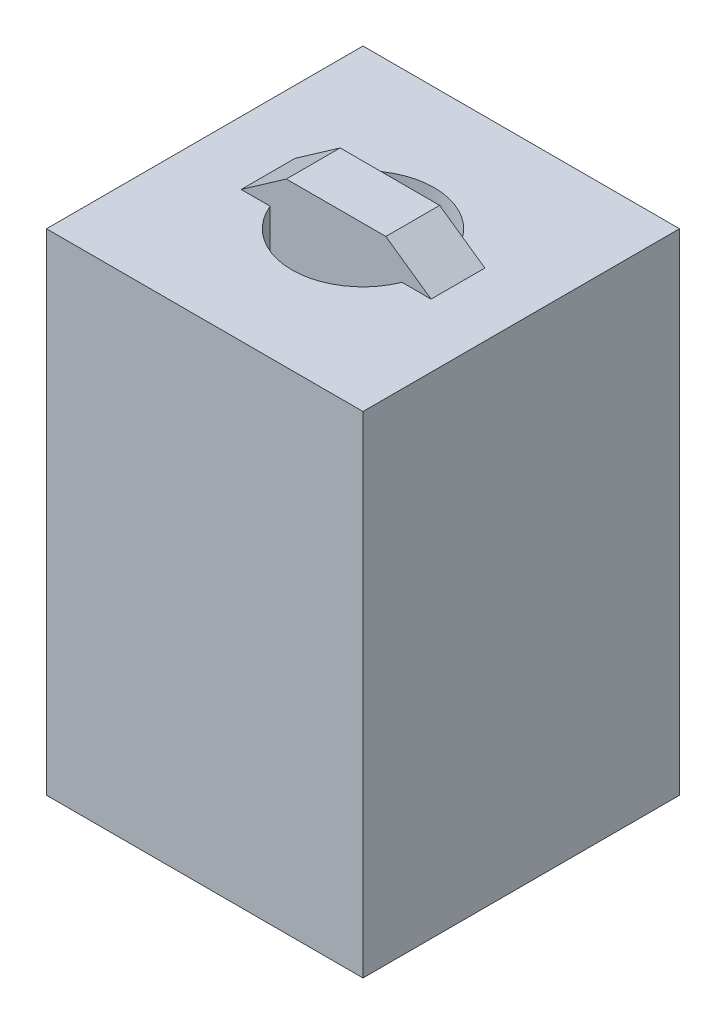
from build123d import *

# Parameters (mm, degrees)
SKETCH1_R           = 12.7
BOSS_EXTRUDE1_DEPTH = 38.1
SKETCH2_R           = 5.715
CUT_EXTRUDE1_DEPTH  = 43.121134838
SKETCH3_R           = 9.3345
CUT_EXTRUDE2_DEPTH  = 12.7
SKETCH4_R           = 12.7
SKETCH4_R_2         = 5.715
BOSS_EXTRUDE2_DEPTH = 1.27
SKETCH5_W           = 11.43
SKETCH5_H           = 4.318
BOSS_EXTRUDE3_DEPTH = 6.35
BOSS_EXTRUDE4_DEPTH = 4.318
BOSS_EXTRUDE5_START = -39.37
BOSS_EXTRUDE5_DEPTH = 39.37


with BuildPart() as part:
    # Sketch1 → Boss-Extrude1 (new body)
    with BuildSketch(Plane(origin=(0, 0, 0), x_dir=(1, 0, 0), z_dir=(0, 1, 0))):
        with Locations(Location((0, 0, 0), (0, 0, 90))):
            Circle(SKETCH1_R)
    extrude(amount=BOSS_EXTRUDE1_DEPTH)

    # Sketch2 → Cut-Extrude1 (cut, through all)
    with BuildSketch(Plane(origin=(0, 38.1, 0), x_dir=(1, 0, 0), z_dir=(0, 1, 0))):
        with Locations(Location((0, 0, 0), (0, 0, 270))):
            Circle(SKETCH2_R)
    extrude(amount=-CUT_EXTRUDE1_DEPTH, mode=Mode.SUBTRACT)

    # Sketch3 → Cut-Extrude2 (cut)
    with BuildSketch(Plane.XZ):
        with Locations(Location((0, 0, 0), (0, 0, 270))):
            Circle(SKETCH3_R)
    extrude(amount=-CUT_EXTRUDE2_DEPTH, mode=Mode.SUBTRACT)

    # Sketch4 → Boss-Extrude2 (add)
    with BuildSketch(Plane(origin=(0, 38.1, 0), x_dir=(1, 0, 0), z_dir=(0, 1, 0))):
        with Locations(Location((0, 0, 0), (0, 0, 90))):
            Circle(SKETCH4_R)
        with Locations(Location((0, 0, 0), (0, 0, 270))):
            Circle(SKETCH4_R_2, mode=Mode.SUBTRACT)
    extrude(amount=BOSS_EXTRUDE2_DEPTH)

    # Sketch5 → Boss-Extrude3 (add)
    with BuildSketch(Plane(origin=(0, 39.37, 0), x_dir=(1, 0, 0), z_dir=(0, 1, 0))):
        Rectangle(SKETCH5_W, SKETCH5_H)
    extrude(amount=-BOSS_EXTRUDE3_DEPTH)

    # Sketch6 → Boss-Extrude4 (add)
    with BuildSketch(Plane(origin=(0, 0, -2.159), x_dir=(-1, 0, 0), z_dir=(0, 0, -1))):
        Polygon((7.62, 39.37), (-7.62, 39.37), (-3.992504063, 41.91), (3.992504063, 41.91), align=None)
    extrude(amount=-BOSS_EXTRUDE4_DEPTH)

    # Sketch7 → Boss-Extrude5 (add)
    with BuildSketch(Plane(origin=(0, 39.37, 0), x_dir=(1, 0, 0), z_dir=(0, 1, 0)).offset(BOSS_EXTRUDE5_START)):
        with BuildLine():
            ThreePointArc((12.7, 0), (8.980256115, -8.980256127), (-1.7e-08, -12.7))
            Line((-1.7e-08, -12.7), (12.7, -12.7))
            Line((12.7, -12.7), (12.7, 0))
        make_face()
        with BuildLine():
            ThreePointArc((-1.7e-08, -12.7), (-8.980256127, -8.980256115), (-12.7, 0))
            Line((-12.7, 0), (-12.7, -12.7))
            Line((-12.7, -12.7), (-1.7e-08, -12.7))
        make_face()
        with BuildLine():
            Line((-12.7, 12.7), (-12.7, 0))
            ThreePointArc((-12.7, 0), (-8.980256122, 8.980256121), (-1e-09, 12.7))
            Line((-1e-09, 12.7), (-12.7, 12.7))
        make_face()
        with BuildLine():
            Line((12.7, 12.7), (-1e-09, 12.7))
            ThreePointArc((-1e-09, 12.7), (8.980256121, 8.980256122), (12.7, 0))
            Line((12.7, 0), (12.7, 12.7))
        make_face()
    extrude(amount=BOSS_EXTRUDE5_DEPTH)


solid = part.part
